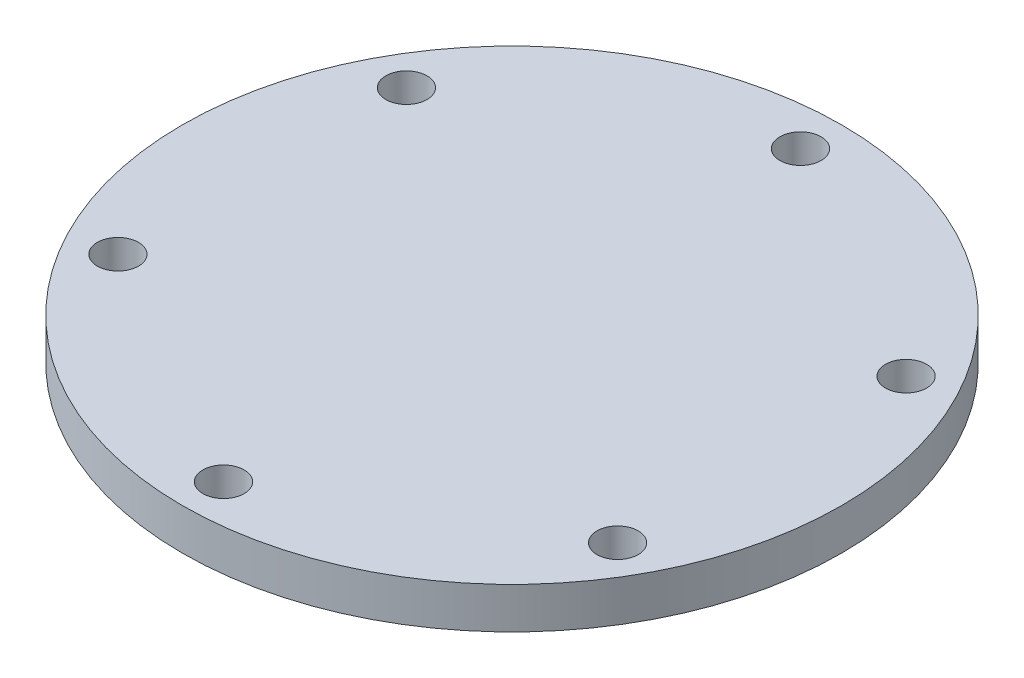
from build123d import *

# Parameters (mm, degrees)
SKETCH1_R                   = 20.32
CYLINDER_DEPTH              = 14.478
SKETCH2_W                   = 7.62
SKETCH2_H                   = 11.938
SKETCH3_W                   = 2.286
SKETCH3_H                   = 2.794
SKETCH4_W                   = 8.87476
SKETCH4_H                   = 6.604
SKETCH5_W                   = 2.286
SKETCH5_H                   = 2.794
BOTTOM_CHAMFER_SIZE         = 3.81
BOTTOM_CHAMFER_SIZE2        = 1.27
MOUNTING_HOLE_REACH         = 34.178
SKETCH6_R                   = 1.27
MOUNTING_HOLE_PATTERN_COUNT = 6


with BuildPart() as part:
    # Sketch1 → Cylinder (new body)
    with BuildSketch(Plane(origin=(0, 0, 0), x_dir=(1, 0, 0), z_dir=(0, 1, 0))):
        with Locations(Location((0, 0, 0), (0, 0, 270))):
            Circle(SKETCH1_R)
    extrude(amount=CYLINDER_DEPTH)

    # Sketch2 → Mid O Ring Wings (revolve, cut)
    with BuildSketch(Plane.XY, mode=Mode.PRIVATE) as mid_o_ring_wings_sk:
        with Locations((16.51, 5.969)):
            Rectangle(SKETCH2_W, SKETCH2_H)
    revolve(mid_o_ring_wings_sk.sketch.rotate(Axis((0, 21.496286204, 0), (0, -1, 0)), 90), axis=Axis((0, 21.496286204, 0), (0, -1, 0)), mode=Mode.SUBTRACT)

    # Sketch3 → Mid O Ring Cut (revolve, cut)
    with BuildSketch(Plane.XY, mode=Mode.PRIVATE) as mid_o_ring_cut_sk:
        with Locations((11.557, 9.271)):
            Rectangle(SKETCH3_W, SKETCH3_H)
    revolve(mid_o_ring_cut_sk.sketch.rotate(Axis((0, 21.496286204, 0), (0, -1, 0)), 90), axis=Axis((0, 21.496286204, 0), (0, -1, 0)), mode=Mode.SUBTRACT)

    # Sketch4 → Bottom O Ring Wings (revolve, cut)
    with BuildSketch(Plane.XY, mode=Mode.PRIVATE) as bottom_o_ring_wings_sk:
        with Locations((8.26262, 3.302)):
            Rectangle(SKETCH4_W, SKETCH4_H)
    revolve(bottom_o_ring_wings_sk.sketch.rotate(Axis((0, 21.496286204, 0), (0, -1, 0)), 90), axis=Axis((0, 21.496286204, 0), (0, -1, 0)), mode=Mode.SUBTRACT)

    # Sketch5 → Bottom O Ring Cut (revolve, cut)
    with BuildSketch(Plane.XY, mode=Mode.PRIVATE) as bottom_o_ring_cut_sk:
        with Locations((2.68224, 3.937)):
            Rectangle(SKETCH5_W, SKETCH5_H)
    revolve(bottom_o_ring_cut_sk.sketch.rotate(Axis((0, 21.496286204, 0), (0, -1, 0)), 90), axis=Axis((0, 21.496286204, 0), (0, -1, 0)), mode=Mode.SUBTRACT)

    # Bottom Chamfer
    bottom_chamfer_edges = [part.edges().sort_by_distance(p)[0] for p in [
        (0, 0, -3.82524),
    ]]
    bottom_chamfer_side = [part.faces().sort_by_distance(p)[0] for p in [
        (0, 0, 0),
    ]]
    chamfer(bottom_chamfer_edges, length=BOTTOM_CHAMFER_SIZE, length2=BOTTOM_CHAMFER_SIZE2, reference=bottom_chamfer_side[0])

    # Sketch6 → Mounting Hole (cut, up to next)
    with BuildSketch(Plane(origin=(0, 14.478, 0), x_dir=(1, 0, 0), z_dir=(0, 1, 0)), mode=Mode.PRIVATE) as mounting_hole_sk1:
        with Locations(Location((0, 17.78, 0), (0, 0, 270))):
            Circle(SKETCH6_R)
    mounting_hole_tool1 = extrude(mounting_hole_sk1.sketch, amount=-MOUNTING_HOLE_REACH, mode=Mode.PRIVATE) & part.part
    mounting_hole = mounting_hole_tool1.solids().sort_by_distance((0, 14.478, -17.78))[0]
    add(mounting_hole, mode=Mode.SUBTRACT)

    # Mounting Hole Pattern: Mounting Hole ×6 about axis
    mounting_hole_pattern_axis = Axis((0, 0, 0), (0, 1, 0))
    for i in range(1, MOUNTING_HOLE_PATTERN_COUNT):
        add(mounting_hole.rotate(mounting_hole_pattern_axis, i * 360 / MOUNTING_HOLE_PATTERN_COUNT), mode=Mode.SUBTRACT)


solid = part.part
